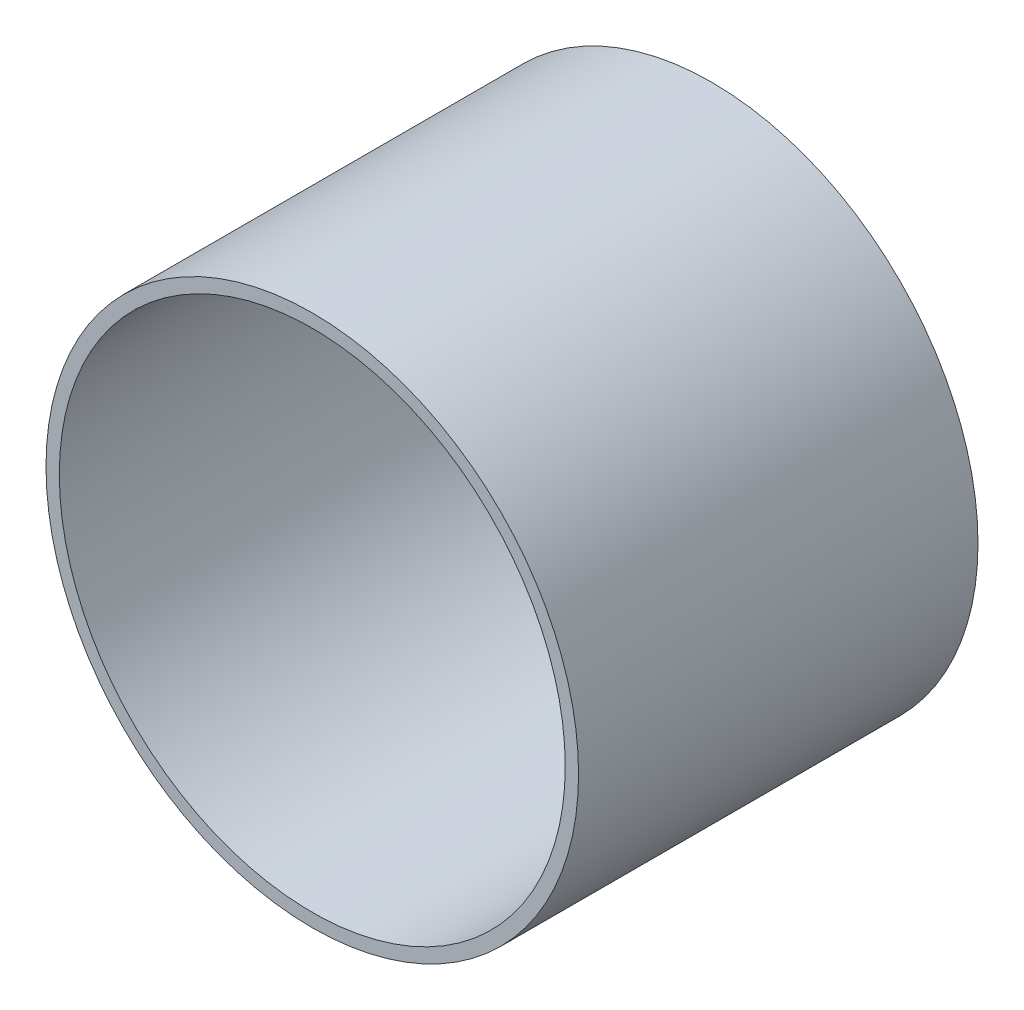
from build123d import *

# Parameters (mm, degrees)
SKETCH1_R           = 100
BOSS_EXTRUDE1_DEPTH = 160
SKETCH2_R           = 95
CUT_EXTRUDE1_DEPTH  = 150
SKETCH3_R           = 10
CUT_EXTRUDE2_DEPTH  = 150
CUT_EXTRUDE4_START  = -10
SKETCH8_R           = 100
CUT_EXTRUDE4_DEPTH  = 10


with BuildPart() as part:
    # Sketch1 → Boss-Extrude1 (new body)
    with BuildSketch(Plane.XY):
        Circle(SKETCH1_R)
    extrude(amount=BOSS_EXTRUDE1_DEPTH)

    # Sketch2 → Cut-Extrude1 (cut)
    with BuildSketch(Plane(origin=(0, 0, 0), x_dir=(-1, 0, 0), z_dir=(0, 0, -1))):
        Circle(SKETCH2_R)
    extrude(amount=-CUT_EXTRUDE1_DEPTH, mode=Mode.SUBTRACT)

    # Sketch3 → Cut-Extrude2 (cut)
    with BuildSketch(Plane.XY.offset(160)):
        Circle(SKETCH3_R)
    extrude(amount=-CUT_EXTRUDE2_DEPTH, mode=Mode.SUBTRACT)

    # Sketch8 → Cut-Extrude4 (cut)
    with BuildSketch(Plane.XY.offset(160).offset(CUT_EXTRUDE4_START)):
        Circle(SKETCH8_R)
    extrude(amount=CUT_EXTRUDE4_DEPTH, mode=Mode.SUBTRACT)


solid = part.part
